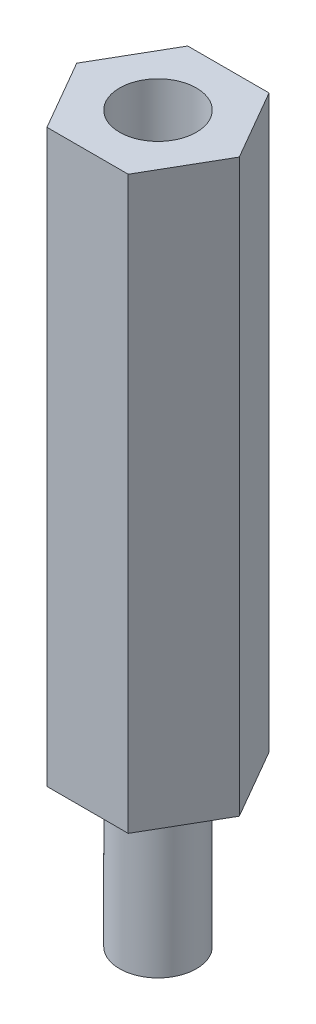
from build123d import *

# Parameters (mm, degrees)
ESQUISSE1_R             = 1.5
BOSS_EXTRU_1_DEPTH      = 22.3
BOSS_EXTRU_2_DEPTH      = 6
BOSS_EXTRU_2_DEPTH_BACK = 1
ESQUISSE2_R             = 1.5


with BuildPart() as part:
    # Esquisse1 → Boss.-Extru.1 (new body)
    with BuildSketch(Plane(origin=(0, 0, 0), x_dir=(1, 0, 0), z_dir=(0, 1, 0))):
        Polygon((1.58771324, 2.75), (-1.58771324, 2.75), (-3.175426481, 0), (-1.58771324, -2.75), (1.58771324, -2.75), (3.175426481, 0), align=None)
        with Locations(Location((0, 0, 0), (0, 0, 270))):
            Circle(ESQUISSE1_R, mode=Mode.SUBTRACT)
    extrude(amount=BOSS_EXTRU_1_DEPTH)

    # Esquisse2 → Boss.-Extru.2 (add, two sides: drawn at the far end of the back side and taken through both)
    with BuildSketch(Plane.XZ.offset(-BOSS_EXTRU_2_DEPTH_BACK)):
        with Locations(Location((0, 0, 0), (0, 0, 270))):
            Circle(ESQUISSE2_R)
    extrude(amount=BOSS_EXTRU_2_DEPTH + BOSS_EXTRU_2_DEPTH_BACK)


solid = part.part
